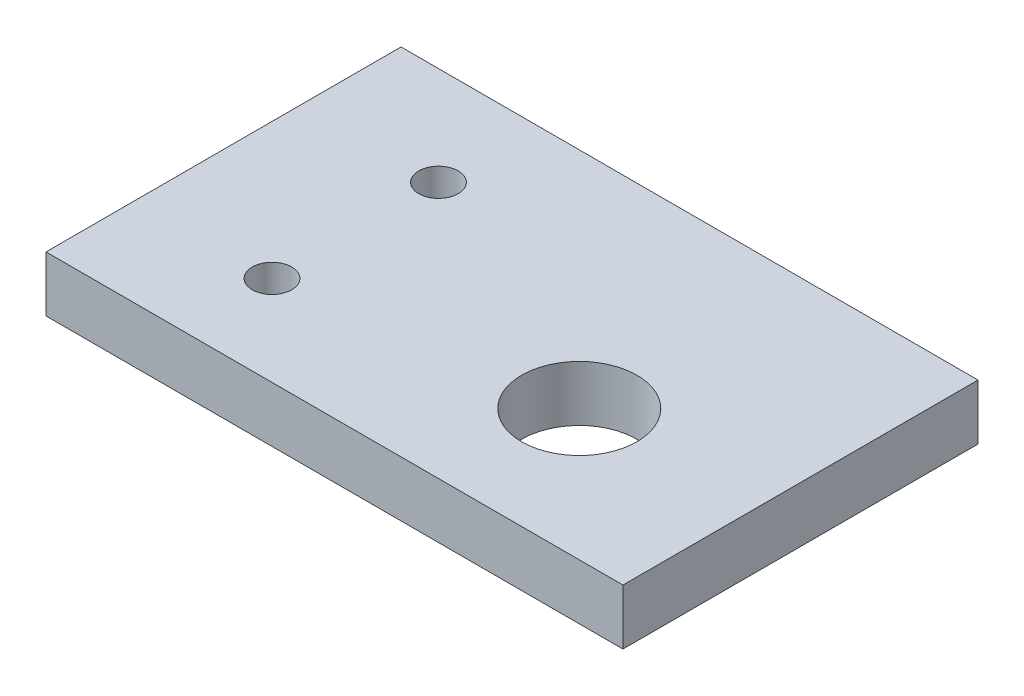
from build123d import *

# Parameters (mm, degrees)
SKETCH1_W           = 33.02
SKETCH1_H           = 20.32
SKETCH1_R           = 3.3
BOSS_EXTRUDE1_DEPTH = 3.175
SKETCH2_R           = 1.1303
CUT_EXTRUDE1_DEPTH  = 39.901200817


with BuildPart() as part:
    # Sketch1 → Boss-Extrude1 (new body)
    with BuildSketch(Plane(origin=(0, 0, 0), x_dir=(1, 0, 0), z_dir=(0, 1, 0))):
        with Locations((16.51, 10.16)):
            Rectangle(SKETCH1_W, SKETCH1_H)
        with Locations(Location((23.02, 7.5, 0), (0, 0, 270))):
            Circle(SKETCH1_R, mode=Mode.SUBTRACT)
    extrude(amount=BOSS_EXTRUDE1_DEPTH)

    # Sketch2 → Cut-Extrude1 (cut, through all)
    with BuildSketch(Plane(origin=(0, 3.175, 0), x_dir=(1, 0, 0), z_dir=(0, 1, 0))):
        with Locations(Location((7.78, 5.1562, 0), (0, 0, 270))):
            Circle(SKETCH2_R)
        with Locations(Location((7.78, 14.6812, 0), (0, 0, 270))):
            Circle(SKETCH2_R)
    extrude(amount=-CUT_EXTRUDE1_DEPTH, mode=Mode.SUBTRACT)


solid = part.part
